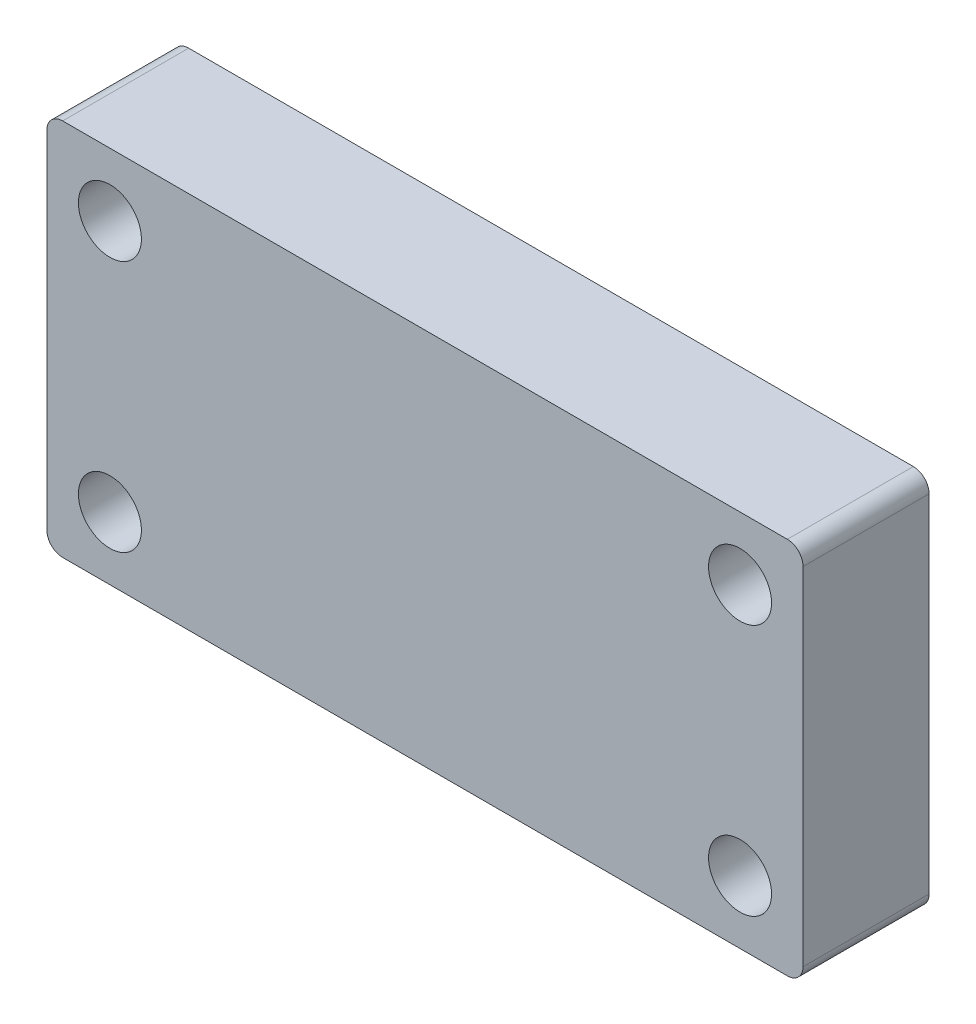
from build123d import *

# Parameters (mm, degrees)
SKETCH2_W           = 19.05
SKETCH2_H           = 9.525
BOSS_EXTRUDE1_DEPTH = 3.175
SKETCH3_R           = 0.79375
CUT_EXTRUDE1_DEPTH  = 12.1125
FILLET1_R           = 0.396875


with BuildPart() as part:
    # Sketch2 → Boss-Extrude1 (new body)
    with BuildSketch(Plane.XY):
        Rectangle(SKETCH2_W, SKETCH2_H)
    extrude(amount=BOSS_EXTRUDE1_DEPTH)

    # Sketch3 → Cut-Extrude1 (cut, through all)
    with BuildSketch(Plane.XY.offset(3.175)):
        with Locations((-7.9375, 3.175)):
            Circle(SKETCH3_R)
        with Locations(Location((-7.9375, -3.175, 0), (0, 0, 180))):
            Circle(SKETCH3_R)
        with Locations((7.9375, -3.175)):
            Circle(SKETCH3_R)
        with Locations(Location((7.9375, 3.175, 0), (0, 0, 180))):
            Circle(SKETCH3_R)
    extrude(amount=-CUT_EXTRUDE1_DEPTH, mode=Mode.SUBTRACT)

    # Fillet1
    fillet1_edges = [part.edges().sort_by_distance(p)[0] for p in [
        (9.525, -4.7625, 1.5875),
        (-9.525, -4.7625, 1.5875),
        (-9.525, 4.7625, 1.5875),
        (9.525, 4.7625, 1.5875),
    ]]
    fillet(fillet1_edges, radius=FILLET1_R)


solid = part.part
